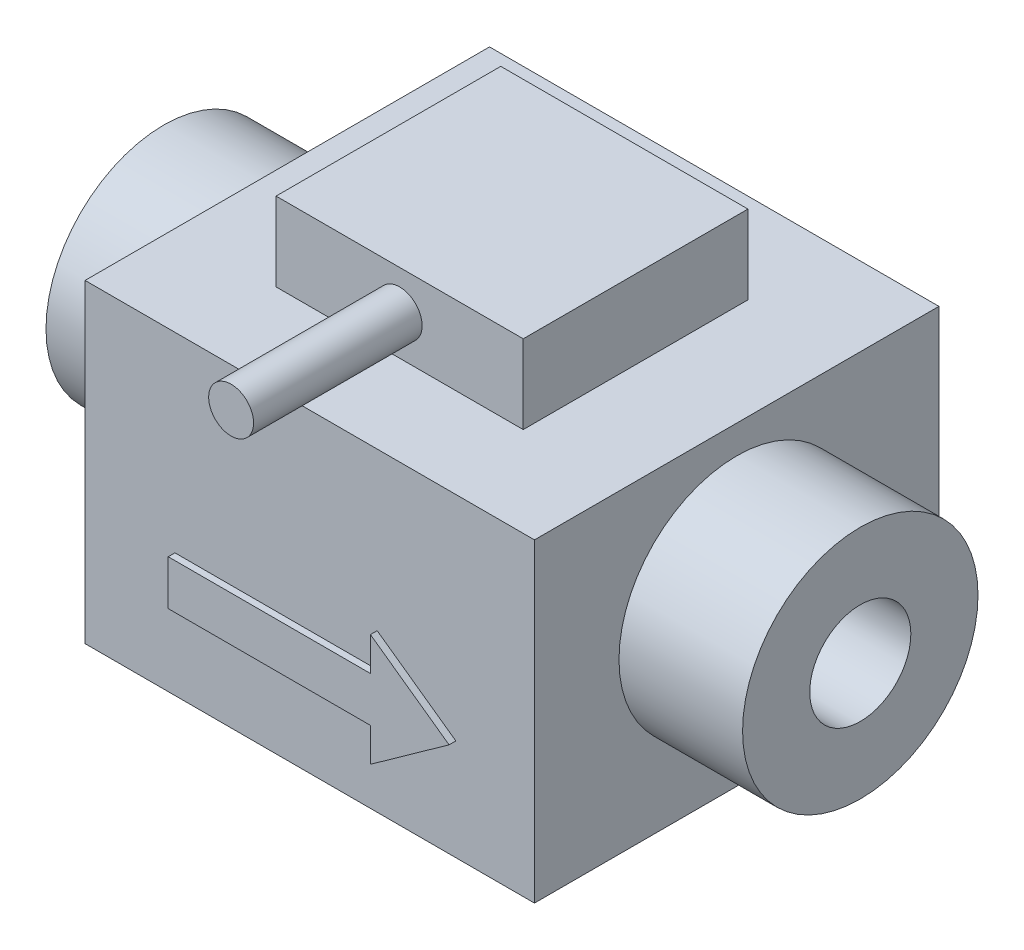
from build123d import *

# Parameters (mm, degrees)
SKETCH1_W            = 40
SKETCH1_H            = 36
BODY_DEPTH           = 28
SENSOR_HOUSING_START = 28
SKETCH2_W            = 22
SKETCH2_H            = 20
SENSOR_HOUSING_DEPTH = 7
INLET_THREAD_START   = -31
SKETCH3_R            = 10.4775
INLET_THREAD_DEPTH   = 11
OUTLET_THREAD_START  = 20
SKETCH4_R            = 10.4775
OUTLET_THREAD_DEPTH  = 11
INLET_BORE_START     = -31
SKETCH5_R            = 4.5
INLET_BORE_DEPTH     = 8
OUTLET_BORE_START    = 23
SKETCH6_R            = 4.5
OUTLET_BORE_DEPTH    = 8
CABLE_STUB_START     = 10
SKETCH7_R            = 2
CABLE_STUB_DEPTH     = 15
FLOW_ARROW_START     = 18
FLOW_ARROW_DEPTH     = 0.6


with BuildPart() as part:
    # Sketch1 → Body (new body)
    with BuildSketch(Plane(origin=(0, 0, 0), x_dir=(1, 0, 0), z_dir=(0, 1, 0))):
        Rectangle(SKETCH1_W, SKETCH1_H)
    extrude(amount=BODY_DEPTH)

    # Sketch2 → Sensor_Housing (add)
    with BuildSketch(Plane(origin=(0, 0, 0), x_dir=(1, 0, 0), z_dir=(0, 1, 0)).offset(SENSOR_HOUSING_START)):
        Rectangle(SKETCH2_W, SKETCH2_H)
    extrude(amount=SENSOR_HOUSING_DEPTH)

    # Sketch3 → Inlet_Thread (add)
    with BuildSketch(Plane(origin=(0, 0, 0), x_dir=(0, 0, -1), z_dir=(1, 0, 0)).offset(INLET_THREAD_START)):
        with Locations((0, 15)):
            Circle(SKETCH3_R)
    extrude(amount=INLET_THREAD_DEPTH)

    # Sketch4 → Outlet_Thread (add)
    with BuildSketch(Plane(origin=(0, 0, 0), x_dir=(0, 0, -1), z_dir=(1, 0, 0)).offset(OUTLET_THREAD_START)):
        with Locations((0, 15)):
            Circle(SKETCH4_R)
    extrude(amount=OUTLET_THREAD_DEPTH)

    # Sketch5 → Inlet_Bore (cut)
    with BuildSketch(Plane(origin=(0, 0, 0), x_dir=(0, 0, -1), z_dir=(1, 0, 0)).offset(INLET_BORE_START)):
        with Locations((0, 15)):
            Circle(SKETCH5_R)
    extrude(amount=INLET_BORE_DEPTH, mode=Mode.SUBTRACT)

    # Sketch6 → Outlet_Bore (cut)
    with BuildSketch(Plane(origin=(0, 0, 0), x_dir=(0, 0, -1), z_dir=(1, 0, 0)).offset(OUTLET_BORE_START)):
        with Locations((0, 15)):
            Circle(SKETCH6_R)
    extrude(amount=OUTLET_BORE_DEPTH, mode=Mode.SUBTRACT)

    # Sketch7 → Cable_Stub (add)
    with BuildSketch(Plane.XY.offset(CABLE_STUB_START)):
        with Locations(Location((0, 31.5, 0), (0, 0, 180))):
            Circle(SKETCH7_R)
    extrude(amount=CABLE_STUB_DEPTH)

    # Sketch8 → Flow_Arrow (add)
    with BuildSketch(Plane.XY.offset(FLOW_ARROW_START)):
        Polygon((-12, 7), (6, 7), (6, 4), (13, 9), (6, 14), (6, 11), (-12, 11), align=None)
    extrude(amount=FLOW_ARROW_DEPTH)


solid = part.part
